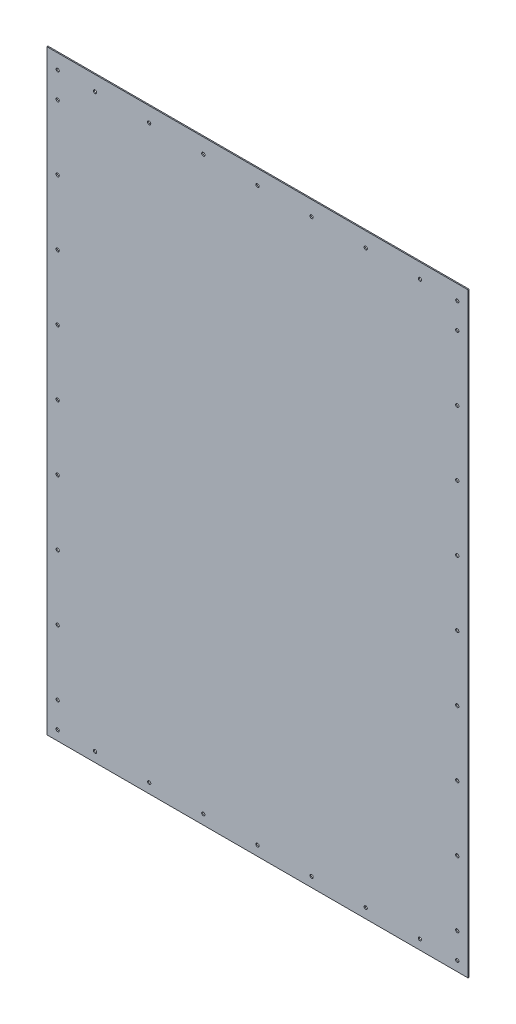
from build123d import *

# Parameters (mm, degrees)
SZKIC1_W                    = 141.828571428
SZKIC1_H                    = 77.957142858
DODANIE_WYCI_GNI_CIE1_DEPTH = 1
SZKIC2_W                    = 1
SZKIC2_H                    = 77.957142858
DODANIE_WYCI_GNI_CIE2_DEPTH = 247.171428571
SZKIC3_W                    = 389
SZKIC3_H                    = 1
DODANIE_WYCI_GNI_CIE3_DEPTH = 472.358223619
SZKIC4_R                    = 1.5
WYTNIJ_WYCI_GNI_CIE1_DEPTH  = 10


with BuildPart() as part:
    # Szkic1 → Dodanie-wyciągnięcie1 (new body)
    with BuildSketch(Plane.XY):
        with Locations((-15.365846009, 10.2)):
            Rectangle(SZKIC1_W, SZKIC1_H)
    extrude(amount=DODANIE_WYCI_GNI_CIE1_DEPTH)

    # Szkic2 → Dodanie-wyciągnięcie2 (add)
    with BuildSketch(Plane.ZY.offset(86.280131723)):
        with Locations((0.5, 10.2)):
            Rectangle(SZKIC2_W, SZKIC2_H)
    extrude(amount=DODANIE_WYCI_GNI_CIE2_DEPTH)

    # Szkic3 → Dodanie-wyciągnięcie3 (add)
    with BuildSketch(Plane.XZ.offset(28.778571429)):
        with Locations((-138.951560295, 0.5)):
            Rectangle(SZKIC3_W, SZKIC3_H)
    extrude(amount=DODANIE_WYCI_GNI_CIE3_DEPTH)

    # Szkic4 → Wytnij-wyciągnięcie1 (cut)
    with BuildSketch(Plane.XY.offset(1)):
        with Locations((45.548439705, -408.367672097)):
            Circle(SZKIC4_R)
        with Locations((-138.951560295, -492.136795048)):
            Circle(SZKIC4_R)
        with Locations((-323.451560295, -492.136795048)):
            Circle(SZKIC4_R)
        with Locations((-323.451560295, -468.367672097)):
            Circle(SZKIC4_R)
        with Locations((-323.451560295, -408.367672097)):
            Circle(SZKIC4_R)
        with Locations((-323.451560295, -348.367672097)):
            Circle(SZKIC4_R)
        with Locations((-323.451560295, -288.367672097)):
            Circle(SZKIC4_R)
        with Locations((-323.451560295, -228.367672097)):
            Circle(SZKIC4_R)
        with Locations((-323.451560295, -168.367672097)):
            Circle(SZKIC4_R)
        with Locations((-323.451560295, -108.367672097)):
            Circle(SZKIC4_R)
        with Locations((-323.451560295, -48.367672097)):
            Circle(SZKIC4_R)
        with Locations((-323.451560295, 11.632327903)):
            Circle(SZKIC4_R)
        with Locations((-323.451560295, 35.401450854)):
            Circle(SZKIC4_R)
        with Locations((-288.951560295, 35.401450854)):
            Circle(SZKIC4_R)
        with Locations((-238.951560295, 35.401450854)):
            Circle(SZKIC4_R)
        with Locations((-188.951560295, 35.401450854)):
            Circle(SZKIC4_R)
        with Locations((-138.951560295, 35.401450854)):
            Circle(SZKIC4_R)
        with Locations((-88.951560295, 35.401450854)):
            Circle(SZKIC4_R)
        with Locations((-38.951560295, 35.401450854)):
            Circle(SZKIC4_R)
        with Locations((11.048439705, 35.401450854)):
            Circle(SZKIC4_R)
        with Locations((45.548439705, 35.401450854)):
            Circle(SZKIC4_R)
        with Locations((45.548439705, 11.632327903)):
            Circle(SZKIC4_R)
        with Locations((45.548439705, -48.367672097)):
            Circle(SZKIC4_R)
        with Locations((45.548439705, -108.367672097)):
            Circle(SZKIC4_R)
        with Locations((45.548439705, -168.367672097)):
            Circle(SZKIC4_R)
        with Locations((45.548439705, -228.367672097)):
            Circle(SZKIC4_R)
        with Locations((45.548439705, -288.367672097)):
            Circle(SZKIC4_R)
        with Locations((45.548439705, -348.367672097)):
            Circle(SZKIC4_R)
        with Locations((45.548439705, -468.367672097)):
            Circle(SZKIC4_R)
        with Locations((45.548439705, -492.136795048)):
            Circle(SZKIC4_R)
        with Locations((11.048439705, -492.136795048)):
            Circle(SZKIC4_R)
        with Locations((-38.951560295, -492.136795048)):
            Circle(SZKIC4_R)
        with Locations((-88.951560295, -492.136795048)):
            Circle(SZKIC4_R)
        with Locations((-188.951560295, -492.136795048)):
            Circle(SZKIC4_R)
        with Locations((-238.951560295, -492.136795048)):
            Circle(SZKIC4_R)
        with Locations((-288.951560295, -492.136795048)):
            Circle(SZKIC4_R)
    extrude(amount=-WYTNIJ_WYCI_GNI_CIE1_DEPTH, mode=Mode.SUBTRACT)


solid = part.part
